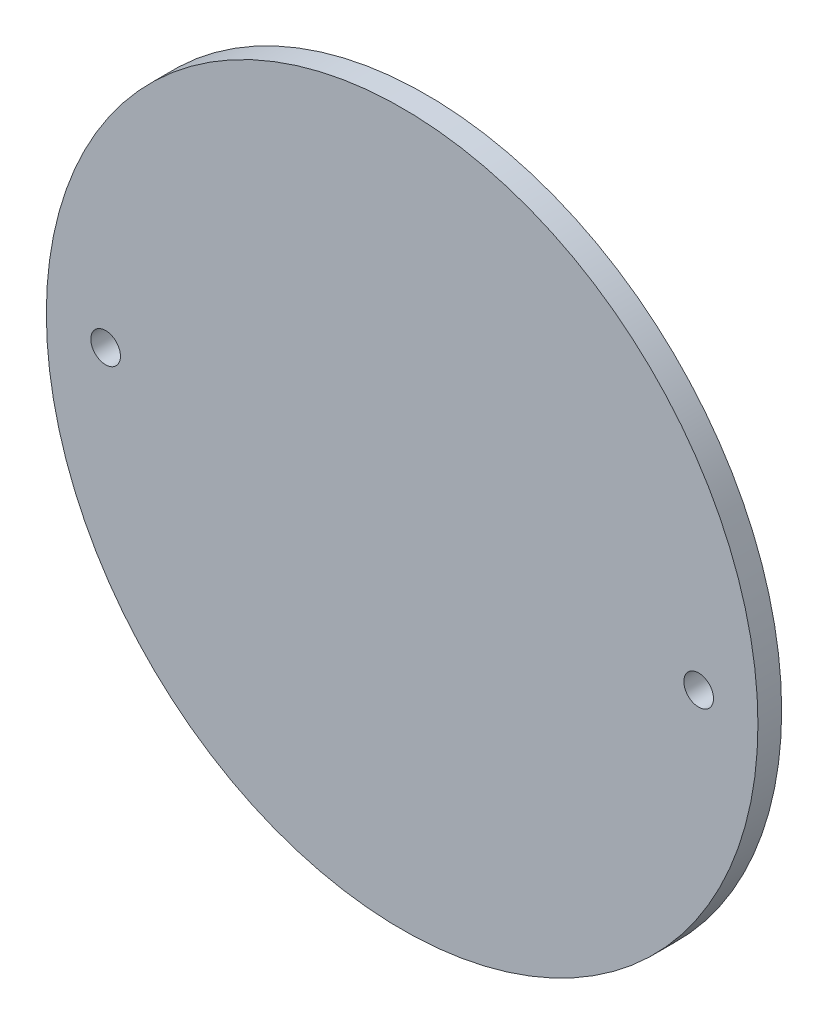
from build123d import *

# Parameters (mm, degrees)
ESQUISSE1_R        = 30
ESQUISSE1_R_2      = 1.25
BOSS_EXTRU_1_DEPTH = 2


with BuildPart() as part:
    # Esquisse1 → Boss.-Extru.1 (new body)
    with BuildSketch(Plane.XY):
        Circle(ESQUISSE1_R)
        with Locations((25, 0)):
            Circle(ESQUISSE1_R_2, mode=Mode.SUBTRACT)
        with Locations((-25, 0)):
            Circle(ESQUISSE1_R_2, mode=Mode.SUBTRACT)
    extrude(amount=BOSS_EXTRU_1_DEPTH)


solid = part.part
